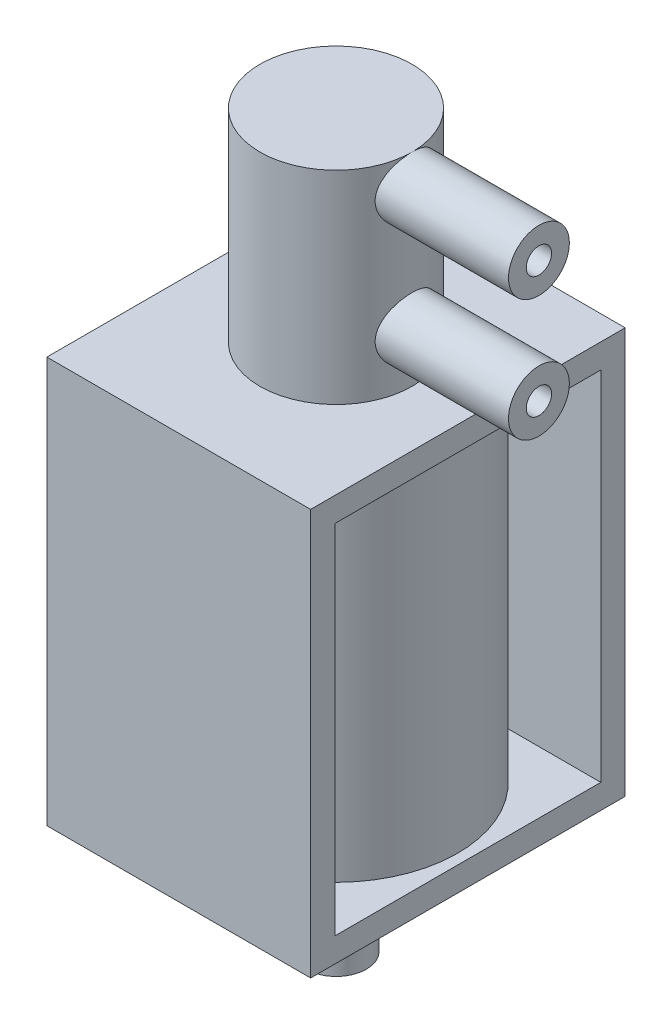
from build123d import *

# Parameters (mm, degrees)
SKETCH_1_W          = 13
SKETCH_1_H          = 15.5
EXTRUDE_291_DEPTH   = 20
SKETCH_2_R          = 1.5
SKETCH_2_R_2        = 0.625
EXTRUDE_3_DEPTH     = 6
SKETCH_3_R          = 3.75
EXTRUDE_583_DEPTH   = 10
SKETCH_4_R          = 1.5
SKETCH_4_R_2        = 0.625
EXTRUDE_746_DEPTH   = 10
EXTRUDE_746_2_DEPTH = 10
SKETCH_6_W          = 13.1
SKETCH_6_H          = 17.6
CUT_EXTRUDE_1_DEPTH = 34.601525263
EXTRUDE_1_REACH     = 33.456
SKETCH_7_R          = 6


with BuildPart() as part:
    # Эскиз1 → Extrude 291 (new body)
    with BuildSketch(Plane(origin=(0, 0, 0), x_dir=(1, 0, 0), z_dir=(0, 1, 0))):
        Rectangle(SKETCH_1_W, SKETCH_1_H)
    extrude(amount=EXTRUDE_291_DEPTH)

    # Эскиз2 → ТрубкаНиз-3мм (add)
    with BuildSketch(Plane.XZ):
        with Locations(Location((0, 0, 0), (0, 0, 270))):
            Circle(SKETCH_2_R)
        with Locations(Location((0, 0, 0), (0, 0, 270))):
            Circle(SKETCH_2_R_2, mode=Mode.SUBTRACT)
    extrude(amount=EXTRUDE_3_DEPTH)

    # Эскиз3 → Extrude 583 (add)
    with BuildSketch(Plane(origin=(0, 20, 0), x_dir=(1, 0, 0), z_dir=(0, 1, 0))):
        with Locations(Location((0, 0, 0), (0, 0, 270))):
            Circle(SKETCH_3_R)
    extrude(amount=EXTRUDE_583_DEPTH)

    # Эскиз6 → Вырез-Вытянуть1 (cut, through all)
    with BuildSketch(Plane(origin=(6.5, 0, 0), x_dir=(0, 0, -1), z_dir=(1, 0, 0))):
        with Locations((0, 10)):
            Rectangle(SKETCH_6_W, SKETCH_6_H)
    extrude(amount=-CUT_EXTRUDE_1_DEPTH, mode=Mode.SUBTRACT)

    # Эскиз7 → Бобышка-Вытянуть1 (add, up to next)
    with BuildSketch(Plane(origin=(0, 1.2, 0), x_dir=(1, 0, 0), z_dir=(0, 1, 0)), mode=Mode.PRIVATE) as extrude_1_sk1:
        with Locations(Location((0, 0, 0), (0, 0, 90))):
            Circle(SKETCH_7_R)
    extrude_1_tool1 = extrude(extrude_1_sk1.sketch, amount=EXTRUDE_1_REACH, mode=Mode.PRIVATE) - part.part
    add(extrude_1_tool1.solids().sort_by_distance((0, 1.2, 0))[0])


with BuildPart() as body_2:
    # Эскиз4 → Extrude 746 (new body)
    with BuildSketch(Plane(origin=(0, 0, 0), x_dir=(0, 0, -1), z_dir=(1, 0, 0))):
        with Locations((0, 28.5)):
            Circle(SKETCH_4_R)
        with Locations((0, 28.5)):
            Circle(SKETCH_4_R_2, mode=Mode.SUBTRACT)
    extrude(amount=EXTRUDE_746_DEPTH)


with BuildPart() as body_3:
    # Эскиз4 → Extrude 746 2 (new body)
    with BuildSketch(Plane(origin=(0, 0, 0), x_dir=(0, 0, -1), z_dir=(1, 0, 0))):
        with Locations((0, 22.5)):
            Circle(SKETCH_4_R)
        with Locations((0, 22.5)):
            Circle(SKETCH_4_R_2, mode=Mode.SUBTRACT)
    extrude(amount=EXTRUDE_746_2_DEPTH)


solid = Compound([part.part, body_2.part, body_3.part])
